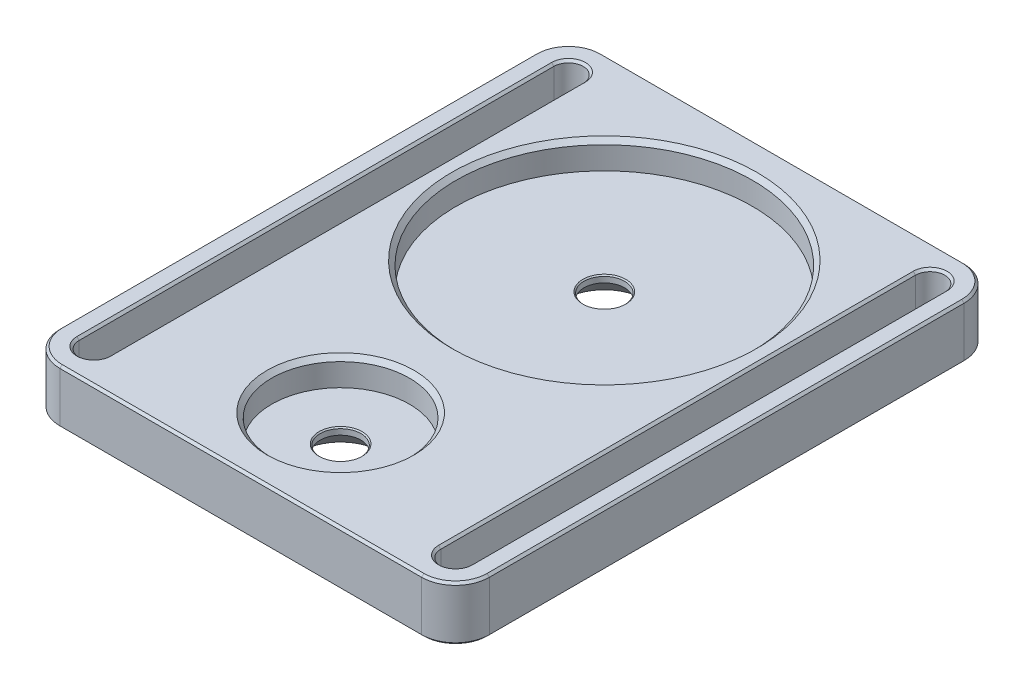
from build123d import *

# Parameters (mm, degrees)
BOSS_EXTRUDE1_DEPTH                             = 12
SKETCH1_4_R                                     = 4.25
CUT_EXTRUDE2_DEPTH                              = 95.16807527
CUT_EXTRUDE3_START                              = 6
SKETCH1_6_R                                     = 32.75
SKETCH1_6_R_2                                   = 4.25
SKETCH1_6_R_3                                   = 15.25
CUT_EXTRUDE3_DEPTH                              = 89.16807527
CHAMFER1_SIZE                                   = 1
CHAMFER2_SIZE                                   = 0.5
CSK_FOR_M8_FLAT_HEAD_MACHINE_SCREW1_D           = 9
CSK_FOR_M8_FLAT_HEAD_MACHINE_SCREW1_CSINK_D     = 18
CSK_FOR_M8_FLAT_HEAD_MACHINE_SCREW1_CSINK_ANGLE = 90


with BuildPart() as part:
    # Sketch1 → Boss-Extrude1 (new body)
    with BuildSketch(Plane(origin=(0, 0, 0), x_dir=(1, 0, 0), z_dir=(0, 1, 0))):
        with BuildLine():
            ThreePointArc((-47.5, -72.92), (-45.303300859, -78.223300859), (-40, -80.42))
            Line((-40, -80.42), (40, -80.42))
            ThreePointArc((40, -80.42), (45.303300859, -78.223300859), (47.5, -72.92))
            Line((47.5, -72.92), (47.5, 32.08))
            ThreePointArc((47.5, 32.08), (45.303300859, 37.383300859), (40, 39.58))
            Line((40, 39.58), (-40, 39.58))
            ThreePointArc((-40, 39.58), (-45.303300859, 37.383300859), (-47.5, 32.08))
            Line((-47.5, 32.08), (-47.5, -72.92))
        make_face()
    extrude(amount=BOSS_EXTRUDE1_DEPTH)

    # Sketch1<4> → Cut-Extrude2 (cut, through all)
    with BuildSketch(Plane(origin=(0, 0, 0), x_dir=(1, 0, 0), z_dir=(0, 1, 0))):
        with BuildLine():
            Line((-36.75, -72.92), (-36.75, 32.08))
            ThreePointArc((-36.75, 32.08), (-40, 35.33), (-43.25, 32.08))
            Line((-43.25, 32.08), (-43.25, -72.92))
            ThreePointArc((-43.25, -72.92), (-40, -76.17), (-36.75, -72.92))
        make_face()
        with BuildLine():
            Line((43.25, -72.92), (43.25, 32.08))
            ThreePointArc((43.25, 32.08), (40, 35.33), (36.75, 32.08))
            Line((36.75, 32.08), (36.75, -72.92))
            ThreePointArc((36.75, -72.92), (40, -76.17), (43.25, -72.92))
        make_face()
        Circle(SKETCH1_4_R)
        with Locations((0, -58.34)):
            Circle(SKETCH1_4_R)
    extrude(amount=CUT_EXTRUDE2_DEPTH, mode=Mode.SUBTRACT)

    # Sketch1<6> → Cut-Extrude3 (cut, through all)
    # profile 1 of 2: a face of its own
    with BuildSketch(Plane(origin=(0, 0, 0), x_dir=(1, 0, 0), z_dir=(0, 1, 0)).offset(CUT_EXTRUDE3_START)):
        Circle(SKETCH1_6_R)
        Circle(SKETCH1_6_R_2, mode=Mode.SUBTRACT)
    # profile 2 of 2: a face of its own
    with BuildSketch(Plane(origin=(0, 0, 0), x_dir=(1, 0, 0), z_dir=(0, 1, 0)).offset(CUT_EXTRUDE3_START)):
        with Locations((0, -58.34)):
            Circle(SKETCH1_6_R_3)
        with Locations((0, -58.34)):
            Circle(SKETCH1_6_R_2, mode=Mode.SUBTRACT)
    extrude(amount=CUT_EXTRUDE3_DEPTH, mode=Mode.SUBTRACT)

    # Chamfer1
    chamfer1_edges = [part.edges().sort_by_distance(p)[0] for p in [
        (-15.25, 12, 58.34),
        (-32.75, 12, 0),
    ]]
    chamfer(chamfer1_edges, length=CHAMFER1_SIZE)

    # Chamfer2
    chamfer2_edges = [part.edges().sort_by_distance(p)[0] for p in [
        (-4.25, 6, 58.34),
        (-4.25, 0, 58.34),
        (-4.25, 6, 0),
        (-4.25, 0, 0),
        (43.25, 12, 20.42),
        (40, 12, -35.33),
        (40, 12, 76.17),
        (36.75, 12, 20.42),
        (43.25, 0, 20.42),
        (40, 0, -35.33),
        (40, 0, 76.17),
        (36.75, 0, 20.42),
        (-36.75, 12, 20.42),
        (-40, 12, -35.33),
        (-40, 12, 76.17),
        (-43.25, 12, 20.42),
        (-36.75, 0, 20.42),
        (-40, 0, -35.33),
        (-40, 0, 76.17),
        (-43.25, 0, 20.42),
        (0, 12, -39.58),
        (-45.303300859, 12, -37.383300859),
        (45.303300859, 12, -37.383300859),
        (-47.5, 12, 20.42),
        (47.5, 12, 20.42),
        (-45.303300859, 12, 78.223300859),
        (45.303300859, 12, 78.223300859),
        (0, 12, 80.42),
        (0, 0, -39.58),
        (-45.303300859, 0, -37.383300859),
        (45.303300859, 0, -37.383300859),
        (-47.5, 0, 20.42),
        (47.5, 0, 20.42),
        (-45.303300859, 0, 78.223300859),
        (45.303300859, 0, 78.223300859),
        (0, 0, 80.42),
    ]]
    chamfer(chamfer2_edges, length=CHAMFER2_SIZE)

    # CSK for M8 Flat Head Machine Screw1 (through all)
    with Locations(Plane(origin=(0, 0, 0), x_dir=(-1, 0, 0), z_dir=(0, -1, 0))):
        with Locations((0, 0), (0, -58.34)):
            CounterSinkHole(CSK_FOR_M8_FLAT_HEAD_MACHINE_SCREW1_D / 2, CSK_FOR_M8_FLAT_HEAD_MACHINE_SCREW1_CSINK_D / 2, counter_sink_angle=CSK_FOR_M8_FLAT_HEAD_MACHINE_SCREW1_CSINK_ANGLE)


solid = part.part
